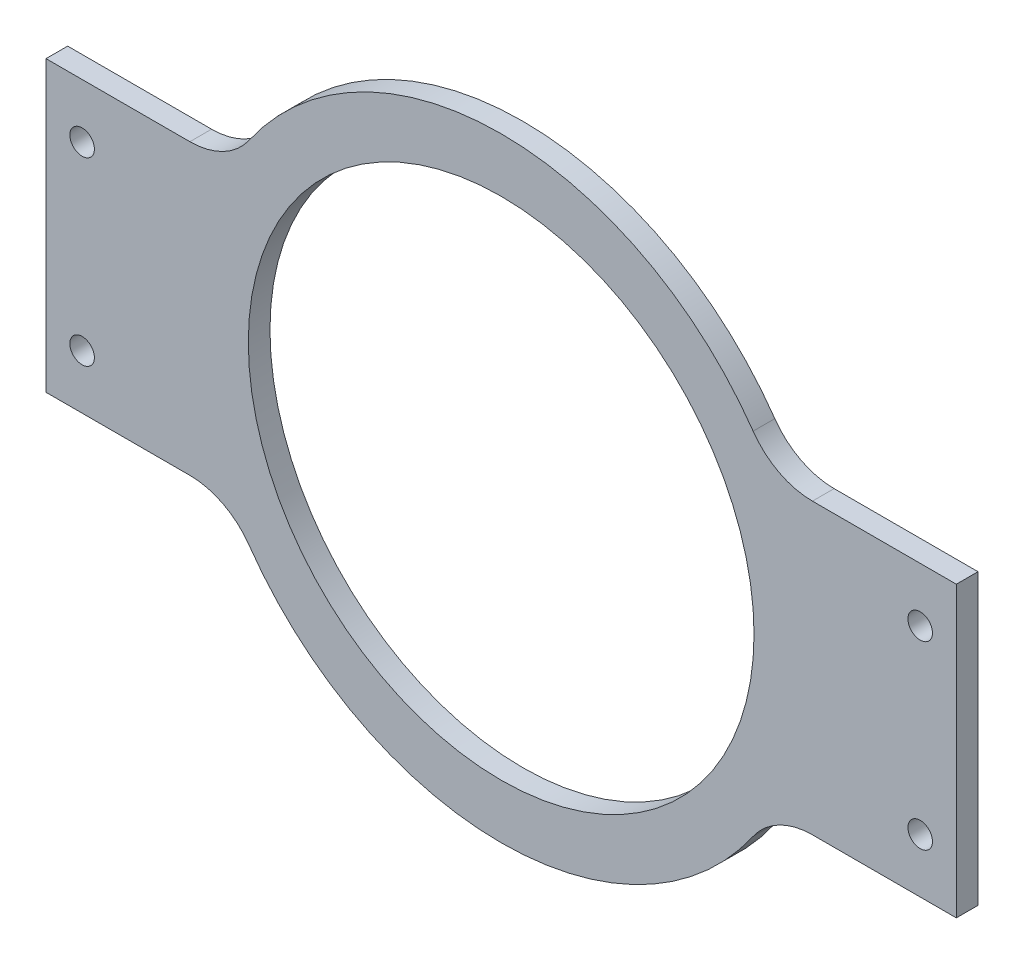
from build123d import *

# Parameters (mm, degrees)
SKETCH1_R            = 35
BOSS_EXTRUDE1_DEPTH  = 1.5
M3_CLEARANCE_HOLE1_D = 3.4
FILLET1_R            = 10


with BuildPart() as part:
    # Sketch1 → Boss-Extrude1 (new, symmetric)
    with BuildSketch(Plane.XY):
        with BuildLine():
            Line((-63, 20), (-37.5, 20))
            ThreePointArc((-37.5, 20), (0, 42.5), (37.5, 20))
            Line((37.5, 20), (63, 20))
            Line((63, 20), (63, -20))
            Line((63, -20), (37.5, -20))
            ThreePointArc((37.5, -20), (0, -42.5), (-37.5, -20))
            Line((-37.5, -20), (-63, -20))
            Line((-63, -20), (-63, 20))
        make_face()
        Circle(SKETCH1_R, mode=Mode.SUBTRACT)
    extrude(amount=BOSS_EXTRUDE1_DEPTH, both=True)

    # M3 Clearance Hole1 (through all)
    with Locations(Plane.XY.offset(1.5)):
        with Locations((-58, 12.5), (-58, -12.5)):
            m3_clearance_hole1 = Hole(M3_CLEARANCE_HOLE1_D / 2)

    # Mirror1: M3 Clearance Hole1 across plane
    add(m3_clearance_hole1.mirror(Plane(origin=(0, 0, 0), x_dir=(0, 0, 1), z_dir=(1, 0, 0))), mode=Mode.SUBTRACT)

    # Fillet1
    fillet1_edges = [part.edges().sort_by_distance(p)[0] for p in [
        (37.5, 20, 0),
        (37.5, -20, 0),
        (-37.5, -20, 0),
        (-37.5, 20, 0),
    ]]
    fillet(fillet1_edges, radius=FILLET1_R)


solid = part.part
